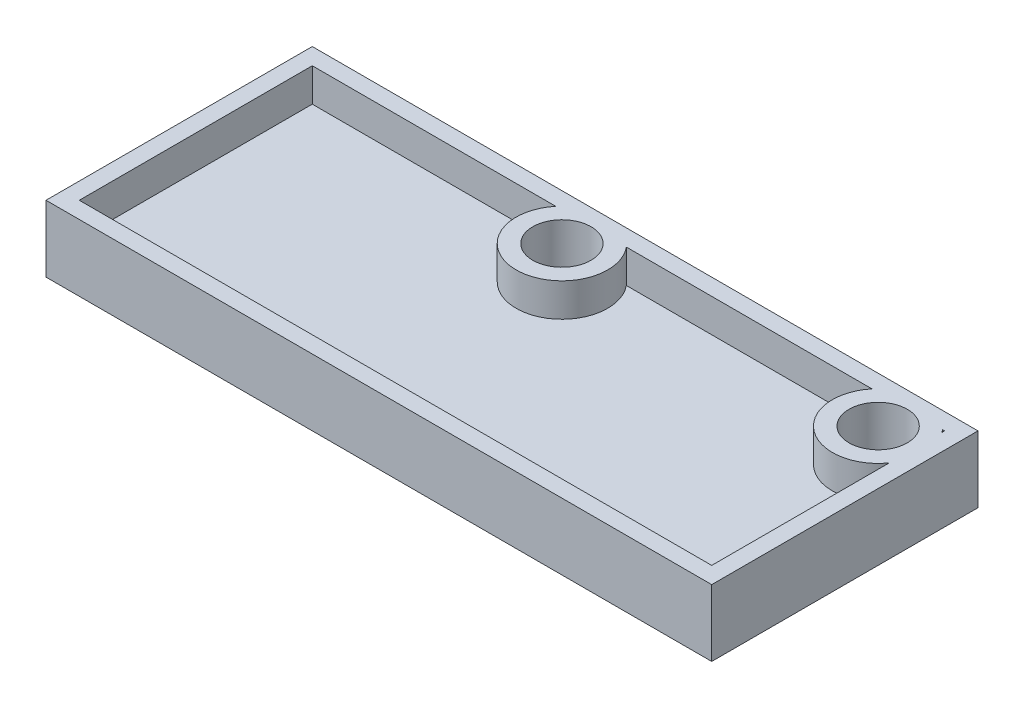
from build123d import *

# Parameters (mm, degrees)
SKETCH1_W           = 40
SKETCH1_H           = 16
BOSS_EXTRUDE1_DEPTH = 2
SKETCH2_W           = 40
SKETCH2_H           = 16
SKETCH2_W_2         = 38
SKETCH2_H_2         = 14
BOSS_EXTRUDE2_DEPTH = 2
BOSS_EXTRUDE5_REACH = 45.267
SKETCH3_R           = 2.75
SKETCH4_R           = 1.75
CUT_EXTRUDE1_DEPTH  = 44.266615306


with BuildPart() as part:
    # Sketch1 → Boss-Extrude1 (new body)
    with BuildSketch(Plane(origin=(0, 0, 0), x_dir=(1, 0, 0), z_dir=(0, 1, 0))):
        with Locations((20, 8)):
            Rectangle(SKETCH1_W, SKETCH1_H)
    extrude(amount=BOSS_EXTRUDE1_DEPTH)

    # Sketch2 → Boss-Extrude2 (add)
    with BuildSketch(Plane(origin=(0, 2, 0), x_dir=(1, 0, 0), z_dir=(0, 1, 0))):
        with Locations((20, 8)):
            Rectangle(SKETCH2_W, SKETCH2_H)
        with Locations((20, 8)):
            Rectangle(SKETCH2_W_2, SKETCH2_H_2, mode=Mode.SUBTRACT)
    extrude(amount=BOSS_EXTRUDE2_DEPTH)

    # Sketch3 → Boss-Extrude5 (add, up to next)
    with BuildSketch(Plane(origin=(0, 4, 0), x_dir=(1, 0, 0), z_dir=(0, 1, 0)), mode=Mode.PRIVATE) as boss_extrude5_sk1:
        with Locations((17.75, 13.25)):
            Circle(SKETCH3_R)
    boss_extrude5_tool1 = extrude(boss_extrude5_sk1.sketch, amount=-BOSS_EXTRUDE5_REACH, mode=Mode.PRIVATE) - part.part
    # Sketch3 → Boss-Extrude5 (add, up to next)
    with BuildSketch(Plane(origin=(0, 4, 0), x_dir=(1, 0, 0), z_dir=(0, 1, 0)), mode=Mode.PRIVATE) as boss_extrude5_sk2:
        with Locations((36.75, 13.25)):
            Circle(SKETCH3_R)
    boss_extrude5_tool2 = extrude(boss_extrude5_sk2.sketch, amount=-BOSS_EXTRUDE5_REACH, mode=Mode.PRIVATE) - part.part
    add(boss_extrude5_tool1.solids().sort_by_distance((17.75, 4, -13.25))[0])
    add(boss_extrude5_tool2.solids().sort_by_distance((36.75, 4, -13.25))[0])

    # Sketch4 → Cut-Extrude1 (cut, through all)
    with BuildSketch(Plane(origin=(0, 4, 0), x_dir=(1, 0, 0), z_dir=(0, 1, 0))):
        with Locations(Location((17.75, 13.25, 0), (0, 0, 270))):
            Circle(SKETCH4_R)
        with Locations(Location((36.75, 13.25, 0), (0, 0, 270))):
            Circle(SKETCH4_R)
    extrude(amount=-CUT_EXTRUDE1_DEPTH, mode=Mode.SUBTRACT)


solid = part.part
